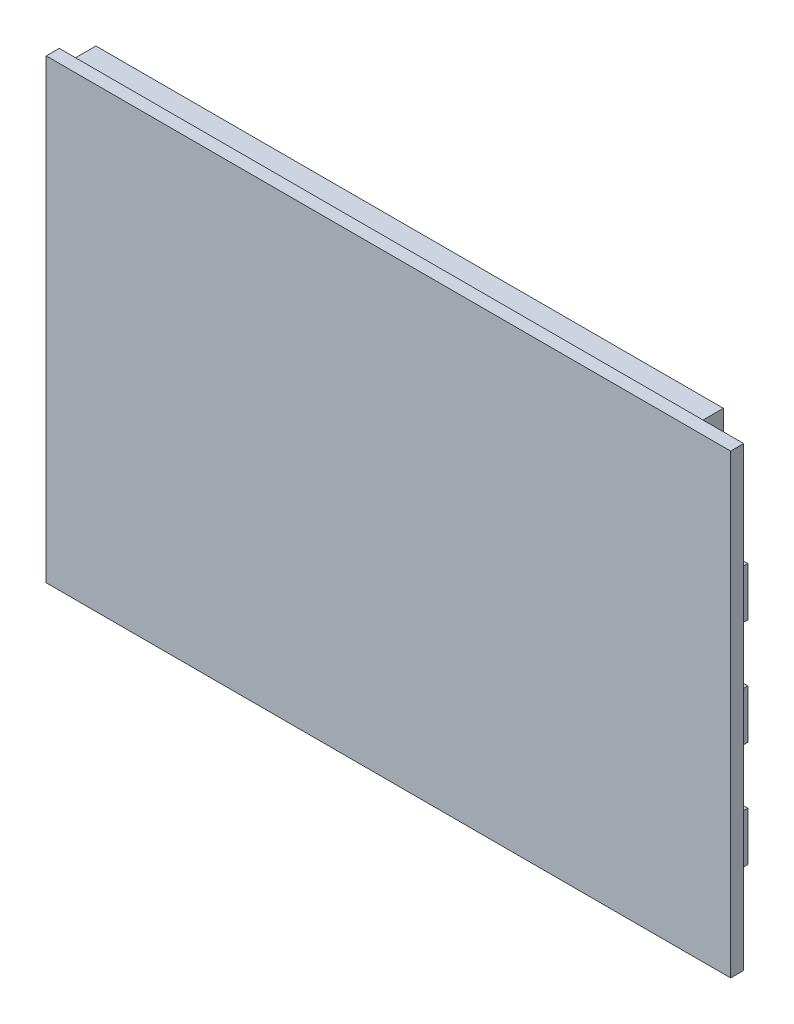
from build123d import *

# Parameters (mm, degrees)
ESQUISSE5_W         = 84
ESQUISSE5_H         = 56
BOSS_EXTRU_6_DEPTH  = 1.6
ESQUISSE6_W         = 77
ESQUISSE6_H         = 54
BOSS_EXTRU_8_DEPTH  = 3.5
ESQUISSE8_W         = 4
ESQUISSE8_H         = 6
BOSS_EXTRU_10_DEPTH = 1.5
ESQUISSE7_W         = 4
ESQUISSE7_H         = 6
BOSS_EXTRU_11_DEPTH = 1.5
ESQUISSE11_W        = 4
ESQUISSE11_H        = 6
BOSS_EXTRU_12_DEPTH = 1.5


with BuildPart() as part:
    # Esquisse5 → Boss.-Extru.6 (new body)
    with BuildSketch(Plane.XY):
        with Locations((42, 28)):
            Rectangle(ESQUISSE5_W, ESQUISSE5_H)
    extrude(amount=BOSS_EXTRU_6_DEPTH)

    # Esquisse6 → Boss.-Extru.8 (add)
    with BuildSketch(Plane(origin=(0, 0, 0), x_dir=(-1, 0, 0), z_dir=(0, 0, -1))):
        with Locations((-39.5, 28)):
            Rectangle(ESQUISSE6_W, ESQUISSE6_H)
    extrude(amount=BOSS_EXTRU_8_DEPTH)

    # Esquisse8 → Boss.-Extru.10 (add)
    with BuildSketch(Plane(origin=(0, 0, 0), x_dir=(-1, 0, 0), z_dir=(0, 0, -1))):
        with Locations((-81, 26)):
            Rectangle(ESQUISSE8_W, ESQUISSE8_H)
    extrude(amount=BOSS_EXTRU_10_DEPTH)

    # Esquisse7 → Boss.-Extru.11 (add)
    with BuildSketch(Plane(origin=(0, 0, 0), x_dir=(-1, 0, 0), z_dir=(0, 0, -1))):
        with Locations((-81, 39)):
            Rectangle(ESQUISSE7_W, ESQUISSE7_H)
    extrude(amount=BOSS_EXTRU_11_DEPTH)

    # Esquisse11 → Boss.-Extru.12 (add)
    with BuildSketch(Plane(origin=(0, 0, 0), x_dir=(-1, 0, 0), z_dir=(0, 0, -1))):
        with Locations((-81, 13)):
            Rectangle(ESQUISSE11_W, ESQUISSE11_H)
    extrude(amount=BOSS_EXTRU_12_DEPTH)


solid = part.part
